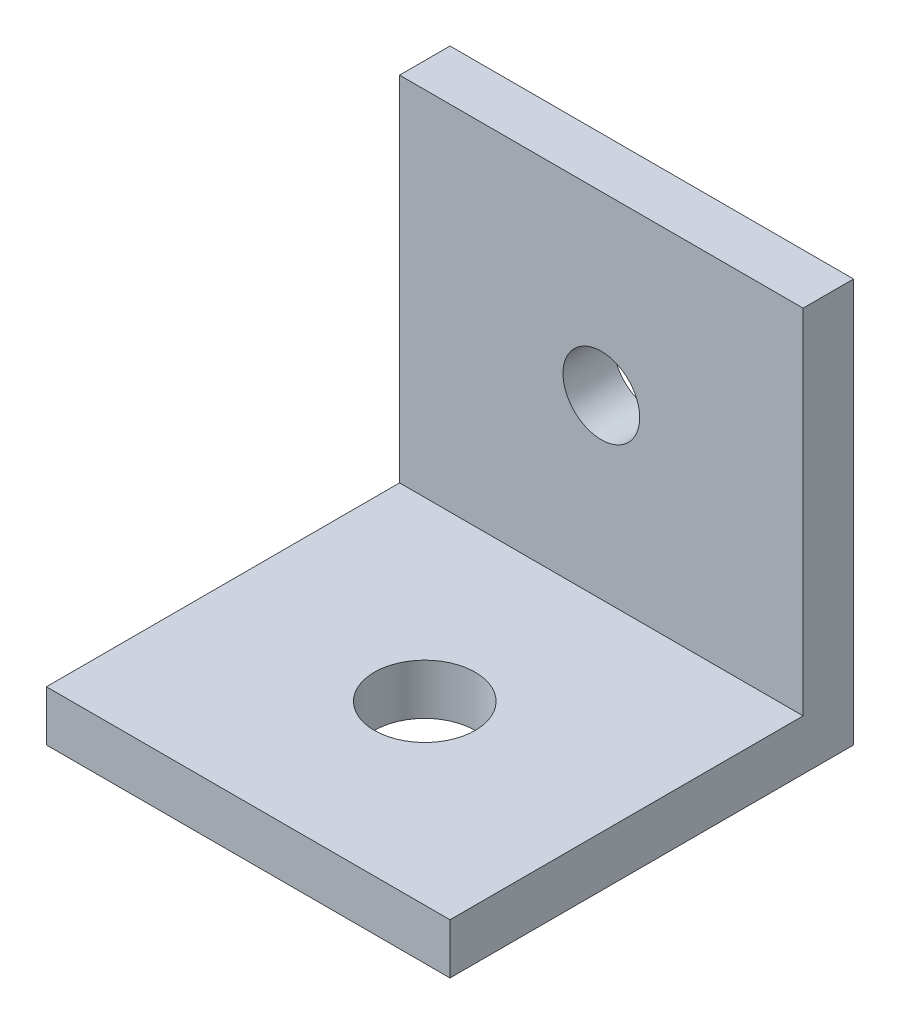
from build123d import *

# Parameters (mm, degrees)
SKETCH1_W           = 25.4
SKETCH1_H           = 25.4
BOSS_EXTRUDE1_DEPTH = 3.175
SKETCH6_W           = 25.4
SKETCH6_H           = 3.175
BOSS_EXTRUDE2_DEPTH = 22.225
SKETCH8_R           = 2.413
CUT_EXTRUDE3_DEPTH  = 3.175
SKETCH9_R           = 3.175
CUT_EXTRUDE4_DEPTH  = 3.175


with BuildPart() as part:
    # Sketch1 → Boss-Extrude1 (new body)
    with BuildSketch(Plane(origin=(0, 0, 0), x_dir=(1, 0, 0), z_dir=(0, 1, 0))):
        Rectangle(SKETCH1_W, SKETCH1_H)
    extrude(amount=BOSS_EXTRUDE1_DEPTH)

    # Sketch6 → Boss-Extrude2 (add)
    with BuildSketch(Plane(origin=(0, 3.175, 0), x_dir=(1, 0, 0), z_dir=(0, 1, 0))):
        with Locations((0, 11.1125)):
            Rectangle(SKETCH6_W, SKETCH6_H)
    extrude(amount=BOSS_EXTRUDE2_DEPTH)

    # Sketch8 → Cut-Extrude3 (cut)
    with BuildSketch(Plane.XY.offset(-9.525)):
        with Locations((0, 14.2875)):
            Circle(SKETCH8_R)
    extrude(amount=-CUT_EXTRUDE3_DEPTH, mode=Mode.SUBTRACT)

    # Sketch9 → Cut-Extrude4 (cut)
    with BuildSketch(Plane(origin=(0, 3.175, 0), x_dir=(1, 0, 0), z_dir=(0, 1, 0))):
        with Locations(Location((0, -1.5875, 0), (0, 0, 270))):
            Circle(SKETCH9_R)
    extrude(amount=-CUT_EXTRUDE4_DEPTH, mode=Mode.SUBTRACT)


solid = part.part
